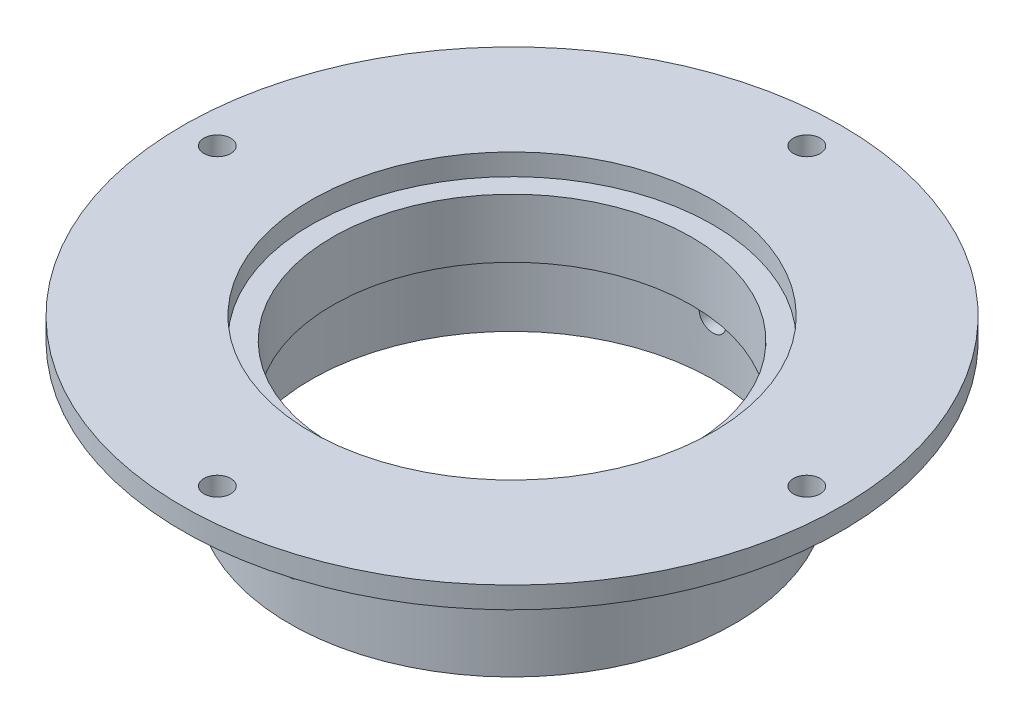
from build123d import *

# Parameters (mm, degrees)
SKETCH2_R               = 2.5
CUT_EXTRUDE3_DEPTH      = 91.495856259
CUT_EXTRUDE6_DEPTH      = 92.681513949
CUT_EXTRUDE6_DEPTH_BACK = 92.681513949
SKETCH6_R               = 2.5


with BuildPart() as part:
    # Sketch1 → Revolve1 (revolve)
    with BuildSketch(Plane.XY, mode=Mode.PRIVATE) as revolve1_sk:
        Polygon((-41.5, -29), (-41.5, -4), (-61.5, -4), (-61.5, 0), (-37.5, 0), (-37.5, -4), (-33.5, -4), (-33.5, -15), (-37.5, -15), (-37.5, -29), align=None)
    revolve(revolve1_sk.sketch.rotate(Axis((0, -100.5, 0), (0, 1, 0)), 270), axis=Axis((0, -100.5, 0), (0, 1, 0)))

    # Sketch2 → Cut-Extrude3 (cut, through all)
    with BuildSketch(Plane.XZ.offset(4)):
        with Locations(Location((55, 0, 0), (0, 0, 270))):
            Circle(SKETCH2_R)
        with Locations(Location((-55, 0, 0), (0, 0, 270))):
            Circle(SKETCH2_R)
        with Locations(Location((0, 55, 0), (0, 0, 270))):
            Circle(SKETCH2_R)
        with Locations(Location((0, -55, 0), (0, 0, 270))):
            Circle(SKETCH2_R)
    extrude(amount=-CUT_EXTRUDE3_DEPTH, mode=Mode.SUBTRACT)

    # Sketch6 → Cut-Extrude6 (cut, two sides: drawn at the far end of the back side and taken through both)
    with BuildSketch(Plane.XY.offset(-CUT_EXTRUDE6_DEPTH_BACK)):
        with Locations((0, -19)):
            Circle(SKETCH6_R)
    extrude(amount=CUT_EXTRUDE6_DEPTH + CUT_EXTRUDE6_DEPTH_BACK, mode=Mode.SUBTRACT)


solid = part.part
